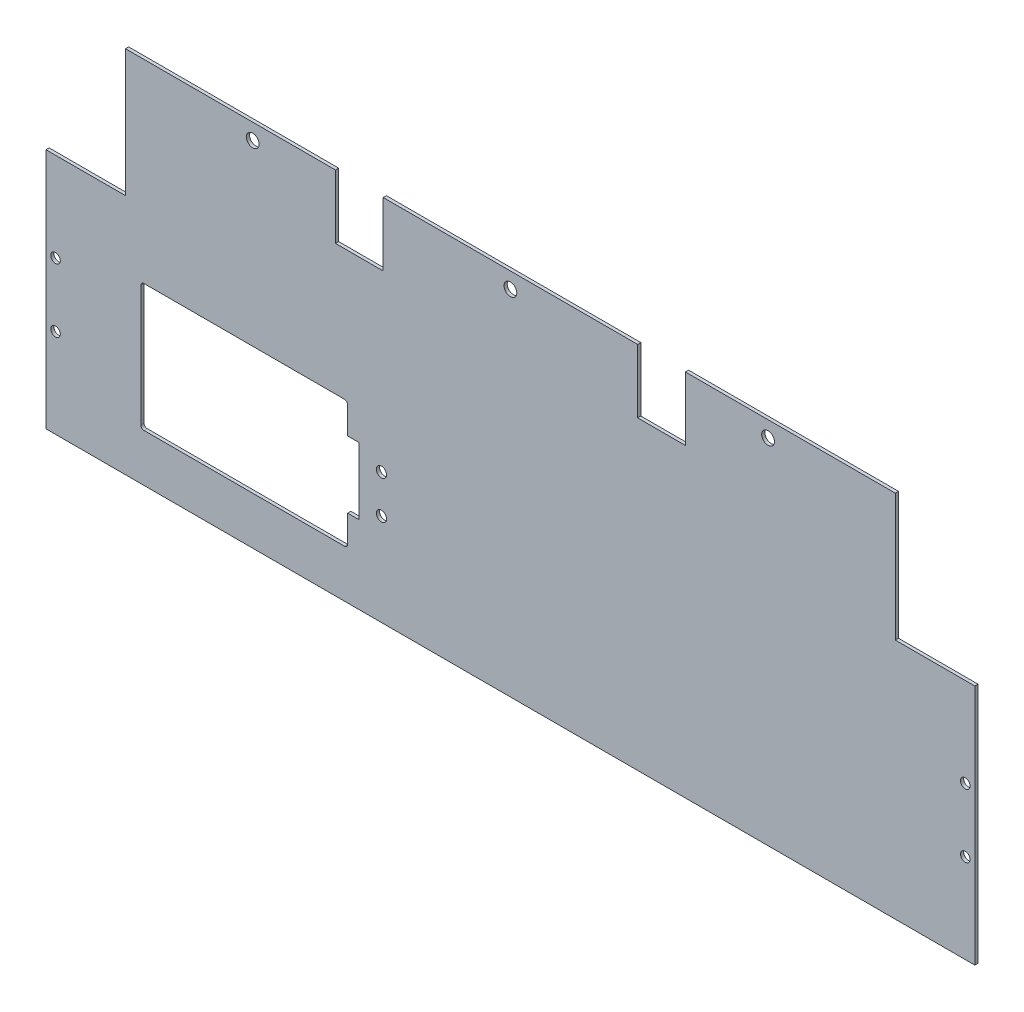
from build123d import *

# Parameters (mm, degrees)
SKETCH_1_R          = 1.5
EXTRUDE_1_DEPTH     = 1
SKETCH_2_R          = 2
SKETCH_2_W          = 15
SKETCH_2_H          = 20
CUT_EXTRUDE_1_DEPTH = 315.198981539
SKETCH_3_W          = 65
SKETCH_3_H          = 40
CUT_EXTRUDE_5_DEPTH = 10
SKETCH_4_W          = 3.5
SKETCH_4_H          = 21
CUT_EXTRUDE_6_DEPTH = 10
SKETCH_6_R          = 1.6
CUT_EXTRUDE_8_DEPTH = 2
FILLET_1_R          = 1


with BuildPart() as part:
    # 草图1 → 凸台-拉伸1 (new body)
    with BuildSketch(Plane.XY):
        Polygon((0, 0), (0, 76), (25, 76), (25, 116), (267, 116), (267, 76), (292, 76), (292, 0), align=None)
        with Locations((3, 48)):
            Circle(SKETCH_1_R, mode=Mode.SUBTRACT)
        with Locations((3, 28)):
            Circle(SKETCH_1_R, mode=Mode.SUBTRACT)
        with Locations(Location((289, 28, 0), (0, 0, 180))):
            Circle(SKETCH_1_R, mode=Mode.SUBTRACT)
        with Locations(Location((289, 48, 0), (0, 0, 180))):
            Circle(SKETCH_1_R, mode=Mode.SUBTRACT)
    extrude(amount=EXTRUDE_1_DEPTH)

    # 草图2 → 切除-拉伸1 (cut, through all)
    with BuildSketch(Plane.XY.offset(1)):
        with Locations((65, 111)):
            Circle(SKETCH_2_R)
        with Locations(Location((227, 111, 0), (0, 0, 180))):
            Circle(SKETCH_2_R)
        with Locations((146, 111)):
            Circle(SKETCH_2_R)
        with Locations((193.5, 106)):
            Rectangle(SKETCH_2_W, SKETCH_2_H)
        with Locations((98.5, 106)):
            Rectangle(SKETCH_2_W, SKETCH_2_H)
    extrude(amount=-CUT_EXTRUDE_1_DEPTH, mode=Mode.SUBTRACT)

    # 草图3 → 切除-拉伸5 (cut)
    with BuildSketch(Plane(origin=(0, 0, 0), x_dir=(-1, 0, 0), z_dir=(0, 0, -1))):
        with Locations((-62.330283152, 34.979584943)):
            Rectangle(SKETCH_3_W, SKETCH_3_H)
    extrude(amount=-CUT_EXTRUDE_5_DEPTH, mode=Mode.SUBTRACT)

    # 草图4 → 切除-拉伸6 (cut)
    with BuildSketch(Plane(origin=(0, 0, 0), x_dir=(-1, 0, 0), z_dir=(0, 0, -1))):
        with Locations((-96.580283152, 34.979584943)):
            Rectangle(SKETCH_4_W, SKETCH_4_H)
    extrude(amount=-CUT_EXTRUDE_6_DEPTH, mode=Mode.SUBTRACT)

    # 草图6 → 切除-拉伸8 (cut)
    with BuildSketch(Plane(origin=(0, 0, 0), x_dir=(-1, 0, 0), z_dir=(0, 0, -1))):
        with Locations((-105.467130331, 28.979584943)):
            Circle(SKETCH_6_R)
        with Locations((-105.467130331, 40.979584943)):
            Circle(SKETCH_6_R)
    extrude(amount=-CUT_EXTRUDE_8_DEPTH, mode=Mode.SUBTRACT)

    # 圆角1
    fillet_1_edges = [part.edges().sort_by_distance(p)[0] for p in [
        (29.830283152, 54.979584943, 0.5),
        (29.830283152, 14.979584943, 0.5),
        (94.830283152, 14.979584943, 0.5),
        (94.830283152, 54.979584943, 0.5),
    ]]
    fillet(fillet_1_edges, radius=FILLET_1_R)


solid = part.part
